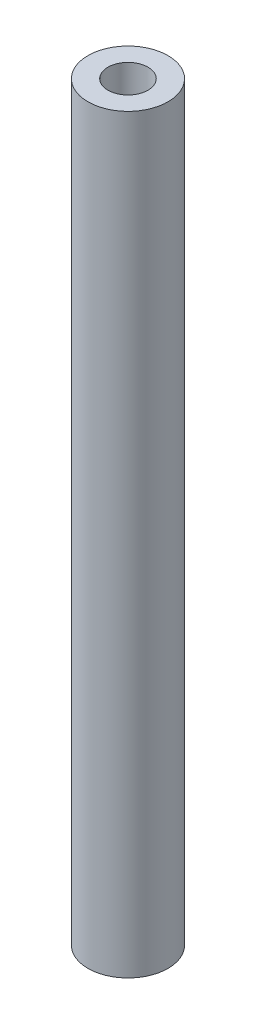
from build123d import *

# Parameters (mm, degrees)
SKETCH1_R           = 4
BOSS_EXTRUDE1_DEPTH = 37.5
SKETCH2_R           = 2
CUT_EXTRUDE1_DEPTH  = 4
CUT_EXTRUDE2_START  = -4
SKETCH3_R           = 2
CUT_EXTRUDE2_DEPTH  = 4


with BuildPart() as part:
    # Sketch1 → Boss-Extrude1 (new, symmetric)
    with BuildSketch(Plane(origin=(0, 0, 0), x_dir=(1, 0, 0), z_dir=(0, 1, 0))):
        with Locations(Location((0, 0, 0), (0, 0, 270))):
            Circle(SKETCH1_R)
    extrude(amount=BOSS_EXTRUDE1_DEPTH, both=True)

    # Sketch2 → Cut-Extrude1 (cut)
    with BuildSketch(Plane(origin=(0, 37.5, 0), x_dir=(1, 0, 0), z_dir=(0, 1, 0))):
        with Locations(Location((0, 0, 0), (0, 0, 270))):
            Circle(SKETCH2_R)
    extrude(amount=-CUT_EXTRUDE1_DEPTH, mode=Mode.SUBTRACT)

    # Sketch3 → Cut-Extrude2 (cut)
    with BuildSketch(Plane.XZ.offset(37.5).offset(CUT_EXTRUDE2_START)):
        with Locations(Location((0, 0, 0), (0, 0, 90))):
            Circle(SKETCH3_R)
    extrude(amount=CUT_EXTRUDE2_DEPTH, mode=Mode.SUBTRACT)


solid = part.part
